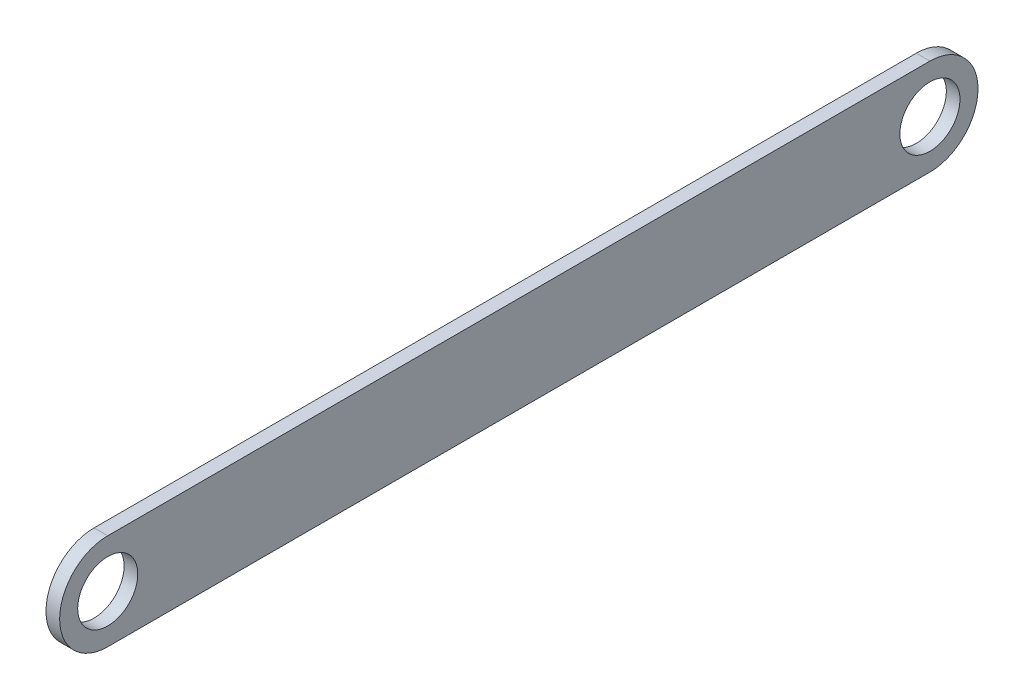
from build123d import *

# Parameters (mm, degrees)
SKETCH1_R           = 63.5
BOSS_EXTRUDE1_DEPTH = 28.829


with BuildPart() as part:
    # Sketch1 → Boss-Extrude1 (new body)
    with BuildSketch(Plane(origin=(0, 0, 0), x_dir=(0, 0, -1), z_dir=(1, 0, 0))):
        with BuildLine():
            Line((0, 101.6), (1737.36, 101.6))
            ThreePointArc((1737.36, 101.6), (1838.96, 0), (1737.36, -101.6))
            Line((1737.36, -101.6), (0, -101.6))
            ThreePointArc((0, -101.6), (-101.6, 0), (0, 101.6))
        make_face()
        with Locations(Location((0, 0, 0), (0, 0, 180))):
            Circle(SKETCH1_R, mode=Mode.SUBTRACT)
        with Locations(Location((1737.36, 0, 0), (0, 0, 180))):
            Circle(SKETCH1_R, mode=Mode.SUBTRACT)
    extrude(amount=BOSS_EXTRUDE1_DEPTH)


solid = part.part
